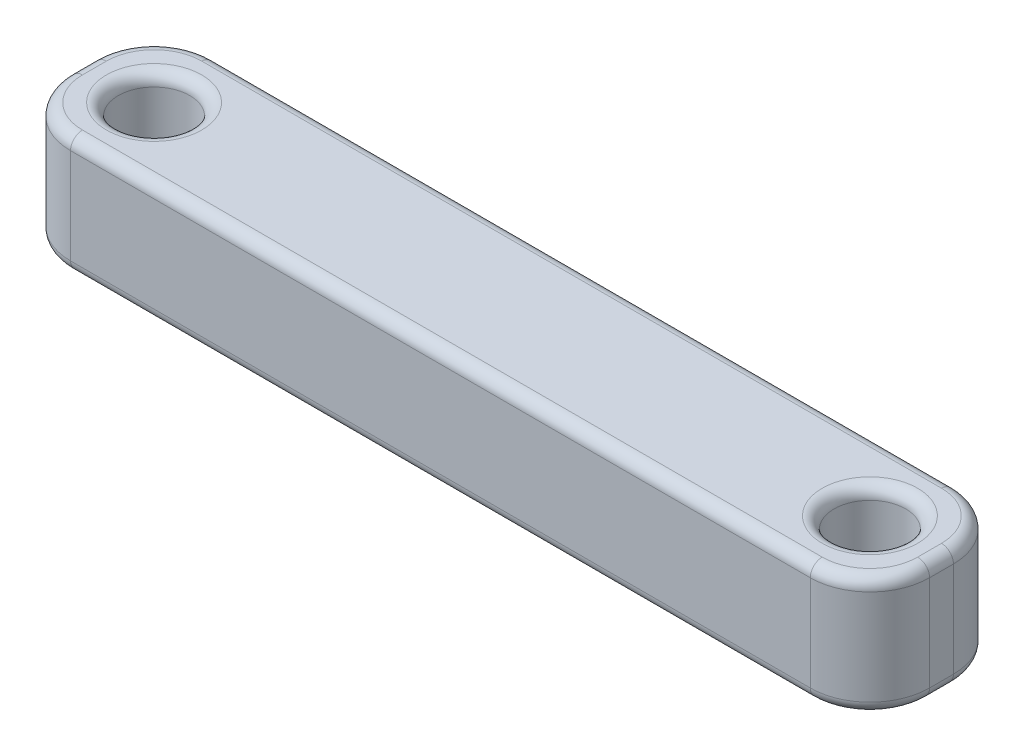
from build123d import *

# Parameters (mm, degrees)
SKETCH1_W           = 36
SKETCH1_H           = 6
BOSS_EXTRUDE1_DEPTH = 5
SKETCH2_R           = 1.5
CUT_EXTRUDE1_DEPTH  = 19.920887928
FILLET1_R           = 2.5
FILLET2_R           = 0.5


with BuildPart() as part:
    # Sketch1 → Boss-Extrude1 (new body)
    with BuildSketch(Plane(origin=(0, 0, 0), x_dir=(1, 0, 0), z_dir=(0, 1, 0))):
        Rectangle(SKETCH1_W, SKETCH1_H)
    extrude(amount=BOSS_EXTRUDE1_DEPTH)

    # Sketch2 → Cut-Extrude1 (cut, through all)
    with BuildSketch(Plane(origin=(0, 5, 0), x_dir=(1, 0, 0), z_dir=(0, 1, 0))):
        with Locations(Location((-15, 0, 0), (0, 0, 270))):
            Circle(SKETCH2_R)
        with Locations(Location((15, 0, 0), (0, 0, 270))):
            Circle(SKETCH2_R)
    extrude(amount=-CUT_EXTRUDE1_DEPTH, mode=Mode.SUBTRACT)

    # Fillet1
    fillet1_edges = [part.edges().sort_by_distance(p)[0] for p in [
        (18, 2.5, 3),
        (-18, 2.5, 3),
        (-18, 2.5, -3),
        (18, 2.5, -3),
    ]]
    fillet(fillet1_edges, radius=FILLET1_R)

    # Fillet2
    fillet2_edges = [part.edges().sort_by_distance(p)[0] for p in [
        (-15, 0, -1.5),
        (-15, 5, -1.5),
        (15, 0, -1.5),
        (15, 5, -1.5),
        (0, 0, -3),
        (0, 5, -3),
        (18, 0, 0),
        (0, 0, 3),
        (-18, 0, 0),
        (-17.267766953, 0, 2.267766953),
        (-17.267766953, 0, -2.267766953),
        (17.267766953, 0, 2.267766953),
        (17.267766953, 0, -2.267766953),
        (18, 5, 0),
        (-18, 5, 0),
        (0, 5, 3),
        (-17.267766953, 5, 2.267766953),
        (-17.267766953, 5, -2.267766953),
        (17.267766953, 5, 2.267766953),
        (17.267766953, 5, -2.267766953),
    ]]
    fillet(fillet2_edges, radius=FILLET2_R)


solid = part.part
